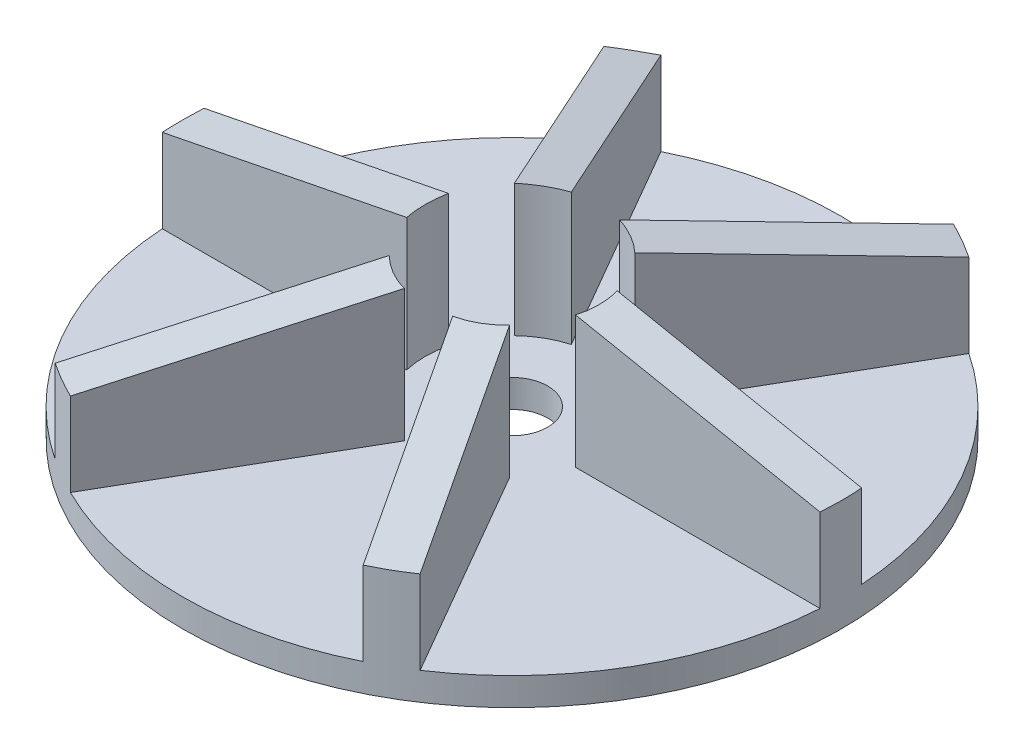
from build123d import *

# Parameters (mm, degrees)
SKETCH5_R           = 30.1117
BOSS_EXTRUDE3_DEPTH = 2.54
BOSS_EXTRUDE4_DEPTH = 1.905
CIRPATTERN2_COUNT   = 6
SKETCH8_R           = 34.925
SKETCH8_R_2         = 30.1117
SKETCH8_R_3         = 7.9375
SKETCH8_R_4         = 3.2639
CUT_EXTRUDE3_DEPTH  = 46.107338309
SKETCH9_R           = 7.9375
SKETCH9_R_2         = 3.2639
BOSS_EXTRUDE5_DEPTH = 2.54


with BuildPart() as part:
    # Sketch5 → Boss-Extrude3 (new body)
    with BuildSketch(Plane(origin=(0, 0, 0), x_dir=(1, 0, 0), z_dir=(0, 1, 0))):
        with Locations(Location((0, 0, 0), (0, 0, 270))):
            Circle(SKETCH5_R)
    extrude(amount=-BOSS_EXTRUDE3_DEPTH)

    # Sketch7 → Boss-Extrude4 (add, symmetric)
    with BuildSketch(Plane.XY):
        Polygon((30.1117, 0), (30.1117, 7.62), (6.35, 12.33424), (6.35, 0), align=None)
    boss_extrude4 = extrude(amount=BOSS_EXTRUDE4_DEPTH, both=True)

    # CirPattern2: Boss-Extrude4 ×6 about axis
    cirpattern2_axis = Axis((0, 0, 0), (0, 1, 0))
    for i in range(1, CIRPATTERN2_COUNT):
        add(boss_extrude4.rotate(cirpattern2_axis, i * 360 / CIRPATTERN2_COUNT))

    # Sketch8 → Cut-Extrude3 (cut, through all)
    # profile 1 of 3: a face of its own
    with BuildSketch(Plane.XZ.offset(2.54)):
        Circle(SKETCH8_R)
        with Locations(Location((0, 0, 0), (0, 0, 90))):
            Circle(SKETCH8_R_2, mode=Mode.SUBTRACT)
    # profile 2 of 3: a face of its own
    with BuildSketch(Plane.XZ.offset(2.54)):
        with Locations(Location((0, 0, 0), (0, 0, 270))):
            Circle(SKETCH8_R_3)
        Circle(SKETCH8_R_4, mode=Mode.SUBTRACT)
    # profile 3 of 3: a face of its own
    with BuildSketch(Plane.XZ.offset(2.54)):
        Circle(SKETCH8_R_4)
    extrude(amount=-CUT_EXTRUDE3_DEPTH, mode=Mode.SUBTRACT)

    # Sketch9 → Boss-Extrude5 (add)
    with BuildSketch(Plane.XZ.offset(2.54)):
        Circle(SKETCH9_R)
        with Locations(Location((0, 0, 0), (0, 0, 270))):
            Circle(SKETCH9_R_2, mode=Mode.SUBTRACT)
    extrude(amount=-BOSS_EXTRUDE5_DEPTH)


solid = part.part
